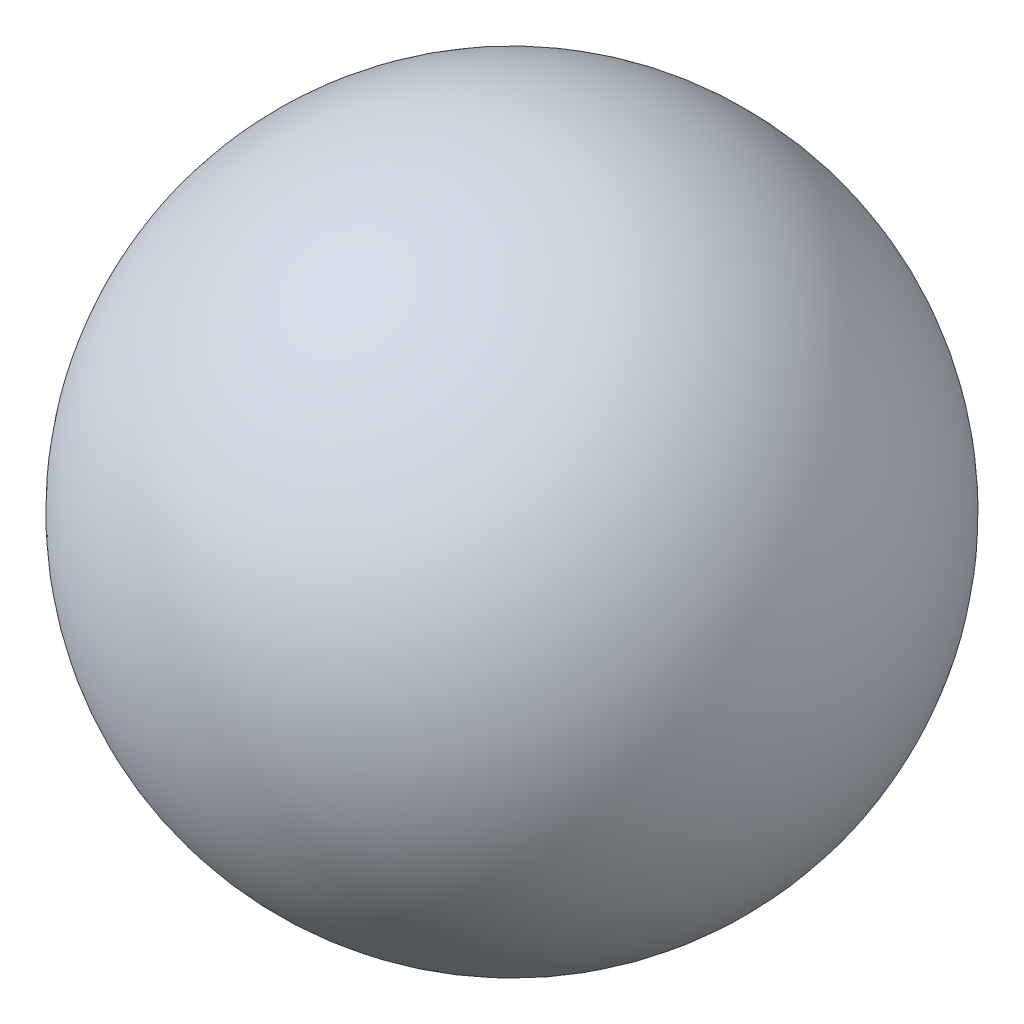
from build123d import *


with BuildPart() as part:
    # Schizzo1 → Rivoluzione1 (revolve)
    with BuildSketch(Plane.XY):
        with BuildLine():
            Line((25.806, 66.275), (1.994, 66.275))
            ThreePointArc((1.994, 66.275), (13.9, 78.181), (25.806, 66.275))
        make_face()
    revolve(axis=Axis((25.806, 66.275, 0), (-1, 0, 0)))


solid = part.part
